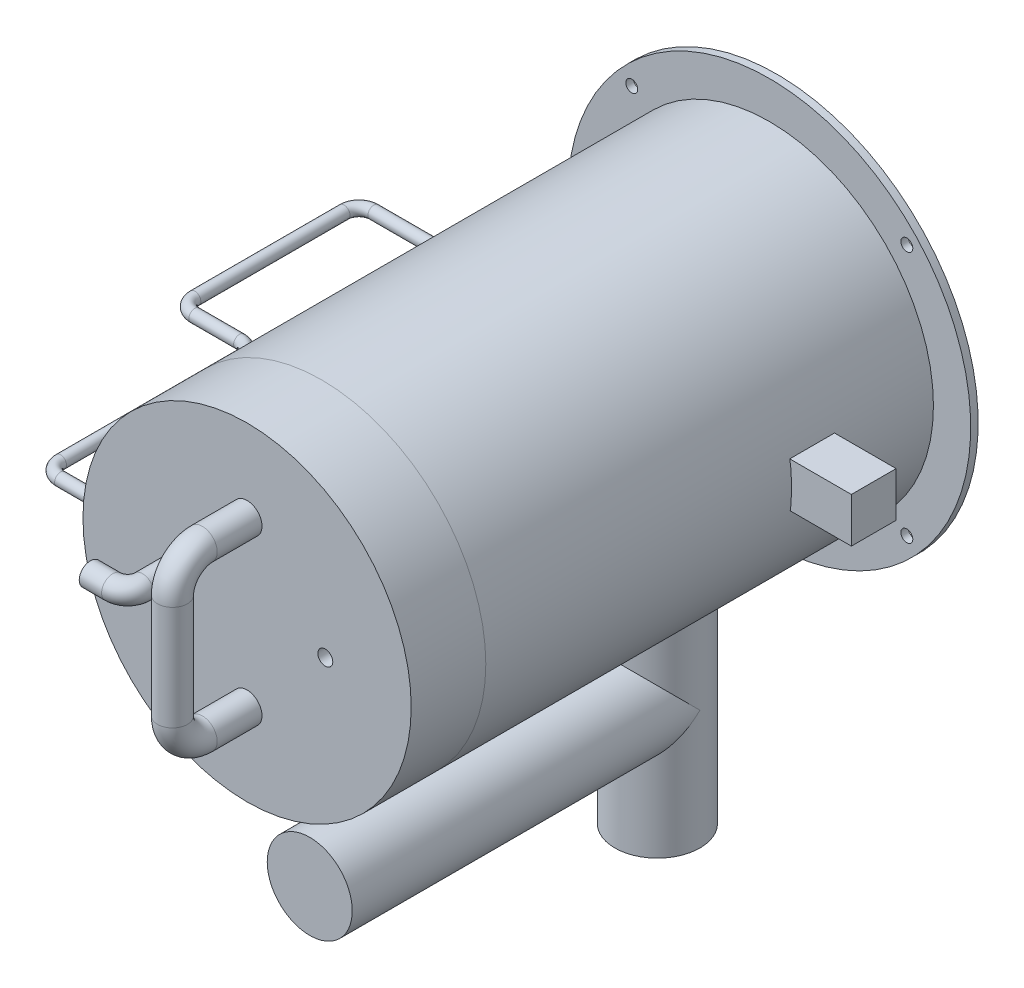
from build123d import *

# Parameters (mm, degrees)
SKETCH_1_R          = 110
EXTRUDE_1_DEPTH     = 50
SKETCH_2_R          = 110
SKETCH_2_R_2        = 90
EXTRUDE_2_DEPTH     = 250
SKETCH_4_R          = 28.5
EXTRUDE_7_DEPTH     = 260
SKETCH_7_R          = 135
EXTRUDE_9_DEPTH     = 5
SKETCH_8_R          = 110
EXTRUDE_10_DEPTH    = 50
SKETCH_9_R          = 4
CUT_EXTRUDE_1_DEPTH = 20
SKETCH_10_W         = 30
SKETCH_10_H         = 30
EXTRUDE_12_DEPTH    = 150
SKETCH_12_R         = 10
SKETCH_14_R         = 7.5
SKETCH_15_R         = 5
CUT_EXTRUDE_2_DEPTH = 125
SKETCH_16_R         = 5
CUT_EXTRUDE_3_DEPTH = 125
SKETCH_18_R         = 4
SKETCH_19_R         = 28.5
EXTRUDE_13_DEPTH    = 233


with BuildPart() as part:
    # 草图1 → 凸台-拉伸1 (new body)
    with BuildSketch(Plane.XY):
        Circle(SKETCH_1_R)
    extrude(amount=EXTRUDE_1_DEPTH)

    # 草图2 → 凸台-拉伸2 (add)
    with BuildSketch(Plane.XY.offset(50)):
        Circle(SKETCH_2_R)
        Circle(SKETCH_2_R_2, mode=Mode.SUBTRACT)
    extrude(amount=EXTRUDE_2_DEPTH)

    # 草图7 → 凸台-拉伸9 (add)
    with BuildSketch(Plane(origin=(0, 0, 0), x_dir=(-1, 0, 0), z_dir=(0, 0, -1))):
        Circle(SKETCH_7_R)
    extrude(amount=EXTRUDE_9_DEPTH)

    # 草图9 → 切除-拉伸1 (cut)
    with BuildSketch(Plane.XY):
        with Locations((92.165859825, 84.442017282)):
            Circle(SKETCH_9_R)
        with Locations((92.165859825, -84.442017282)):
            Circle(SKETCH_9_R)
        with Locations((-92.165859825, -84.442017282)):
            Circle(SKETCH_9_R)
        with Locations((-92.165859825, 84.442017282)):
            Circle(SKETCH_9_R)
    extrude(amount=-CUT_EXTRUDE_1_DEPTH, mode=Mode.SUBTRACT)


with BuildPart() as body_2:
    # 草图4 → 凸台-拉伸7 (new body)
    with BuildSketch(Plane(origin=(0, 0, 0), x_dir=(1, 0, 0), z_dir=(0, 1, 0))):
        with Locations((0, -75)):
            Circle(SKETCH_4_R)
    extrude(amount=-EXTRUDE_7_DEPTH)

    # 草图16 → 切除-拉伸3 (cut)
    with BuildSketch(Plane(origin=(0, -260, 0), x_dir=(-1, 0, 0), z_dir=(0, -1, 0))):
        with Locations((0, -75)):
            Circle(SKETCH_16_R)
    extrude(amount=-CUT_EXTRUDE_3_DEPTH, mode=Mode.SUBTRACT)

    # 草图19 → 凸台-拉伸13 (add)
    with BuildSketch(Plane(origin=(0, 0, 75), x_dir=(-1, 0, 0), z_dir=(0, 0, -1))):
        with Locations((0, -180)):
            Circle(SKETCH_19_R)
    extrude(amount=-EXTRUDE_13_DEPTH)


with BuildPart() as body_3:
    # 草图8 → 凸台-拉伸10 (new body)
    with BuildSketch(Plane.XY.offset(300)):
        Circle(SKETCH_8_R)
    extrude(amount=EXTRUDE_10_DEPTH)

    # 扫描1: sweep along a path in 草图11
    with BuildLine(Plane(origin=(0, 0, 0), x_dir=(0, 0, -1), z_dir=(1, 0, 0))) as sweep_1_path:
        Line((-350, 55), (-380, 55))
        ThreePointArc((-380, 55), (-394.142135624, 49.142135624), (-400, 35))
        Line((-400, 35), (-400, -35))
        ThreePointArc((-400, -35), (-394.142135624, -49.142135624), (-380, -55))
        Line((-380, -55), (-350, -55))
    # 草图12 → 扫描1 (sweep)
    with BuildSketch(Plane.XY.offset(350)):
        with Locations((0, 55)):
            Circle(SKETCH_12_R)
    sweep(path=sweep_1_path.line)

    # 扫描2: sweep along a path in 草图13
    with BuildLine(Plane(origin=(0, 0, 0), x_dir=(1, 0, 0), z_dir=(0, 1, 0))) as sweep_2_path:
        Line((-50, -350), (-50, -370))
        ThreePointArc((-50, -370), (-52.928932188, -377.071067812), (-60, -380))
        Line((-60, -380), (-75, -380))
    # 草图14 → 扫描2 (sweep)
    with BuildSketch(Plane.XY.offset(350)):
        with Locations((-50, 0)):
            Circle(SKETCH_14_R)
    sweep(path=sweep_2_path.line)

    # 草图15 → 切除-拉伸2 (cut)
    with BuildSketch(Plane.XY.offset(350)):
        with Locations((52.431981601, 0)):
            Circle(SKETCH_15_R)
    extrude(amount=-CUT_EXTRUDE_2_DEPTH, mode=Mode.SUBTRACT)


with BuildPart() as body_4:
    # 草图10 → 凸台-拉伸12 (new body)
    with BuildSketch(Plane(origin=(0, 0, 0), x_dir=(0, 0, -1), z_dir=(1, 0, 0))):
        with Locations((-80, 0.988539582)):
            Rectangle(SKETCH_10_W, SKETCH_10_H)
    extrude(amount=EXTRUDE_12_DEPTH)


with BuildPart() as body_5:
    # 扫描4: sweep along a path in 草图17
    with BuildLine(Plane(origin=(0, 0, 0), x_dir=(1, 0, 0), z_dir=(0, 1, 0))) as sweep_4_path:
        Line((0, -75), (-190, -75))
        ThreePointArc((-190, -75), (-197.071067812, -77.928932188), (-200, -85))
        Line((-200, -85), (-200, -185))
        ThreePointArc((-200, -185), (-197.071067812, -192.071067812), (-190, -195))
        Line((-190, -195), (-160, -195))
        ThreePointArc((-160, -195), (-152.928932188, -197.928932188), (-150, -205))
        Line((-150, -205), (-150, -325))
        ThreePointArc((-150, -325), (-147.071067812, -332.071067812), (-140, -335))
        Line((-140, -335), (0, -335))
    # 草图18 → 扫描4 (sweep)
    with BuildSketch(Plane(origin=(0, 0, 0), x_dir=(0, 0, -1), z_dir=(1, 0, 0))):
        with Locations((-75, 0)):
            Circle(SKETCH_18_R)
    sweep(path=sweep_4_path.line)


solid = Compound([part.part, body_2.part, body_3.part, body_4.part, body_5.part])
